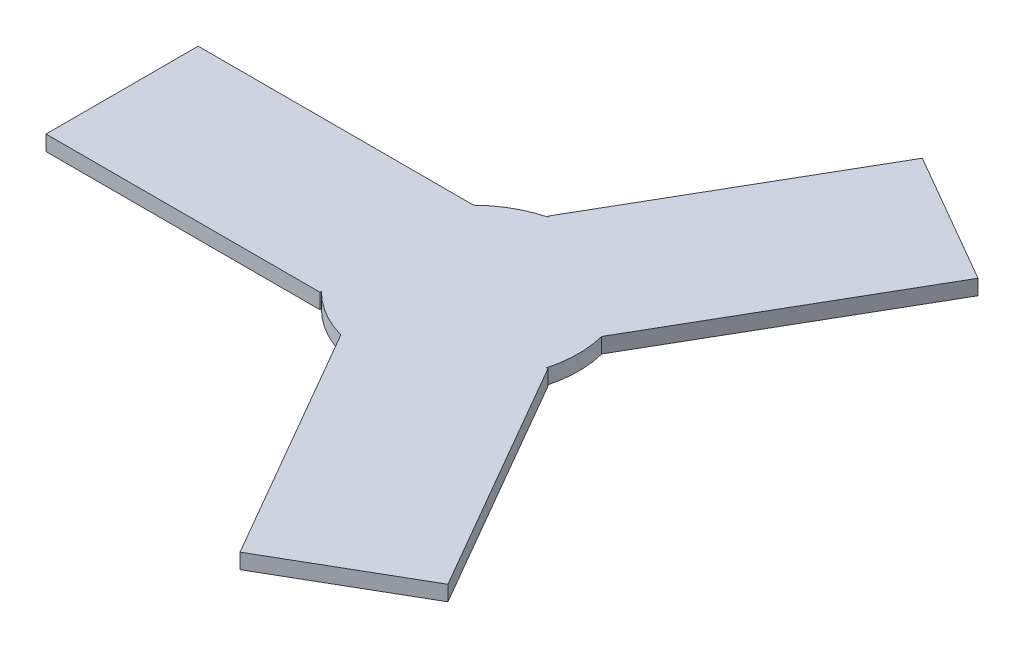
from build123d import *

# Parameters (mm, degrees)
ESQUISSE3_R        = 35
BOSS_EXTRU_3_DEPTH = 5


with BuildPart() as part:
    # Esquisse3 → Boss.-Extru.3 (new body)
    with BuildSketch(Plane(origin=(0, 0, 0), x_dir=(1, 0, 0), z_dir=(0, 1, 0))):
        with BuildLine():
            Line((-115, -25), (-25, -25))
            Line((-25, -25), (-24.99494949, -24.500051021))
            ThreePointArc((-24.99494949, -24.500051021), (-34.998214236, 0.353553761), (-24.494897428, 25))
            Line((-24.494897428, 25), (-25, 25))
            Line((-25, 25), (-115, 25))
            Line((-115, 25), (-115, -25))
        make_face()
        Circle(ESQUISSE3_R)
        Polygon((-9.403186381, -33.713203436), (35.849364905, -112.092921435), (79.150635095, -87.092921435), (34.150635095, -9.150635095), align=None)
        with BuildLine():
            Line((-24.494897428, 25), (-24.99494949, -24.500051021))
            ThreePointArc((-24.99494949, -24.500051021), (-17.805293657, -30.132565736), (-9.403186381, -33.713203436))
            Line((-9.403186381, -33.713203436), (33.715141323, -9.396235714))
            ThreePointArc((33.715141323, -9.396235714), (34.677297662, -4.741837919), (35, 0))
            ThreePointArc((35, 0), (34.72342821, 4.391302011), (33.898083809, 8.713203436))
            Line((33.898083809, 8.713203436), (-8.720191833, 33.896286735))
            ThreePointArc((-8.720191833, 33.896286735), (-17.19292058, 30.486119496), (-24.494897428, 25))
        make_face()
        Circle(ESQUISSE3_R)
        Polygon((33.898083809, 8.713203436), (79.150635095, 87.092921435), (35.849364905, 112.092921435), (-9.150635095, 34.150635095), align=None)
        with BuildLine():
            ThreePointArc((33.898083809, 8.713203436), (17.805293657, 30.132565736), (-8.720191833, 33.896286735))
            Line((-8.720191833, 33.896286735), (33.898083809, 8.713203436))
        make_face()
    extrude(amount=BOSS_EXTRU_3_DEPTH)


solid = part.part
